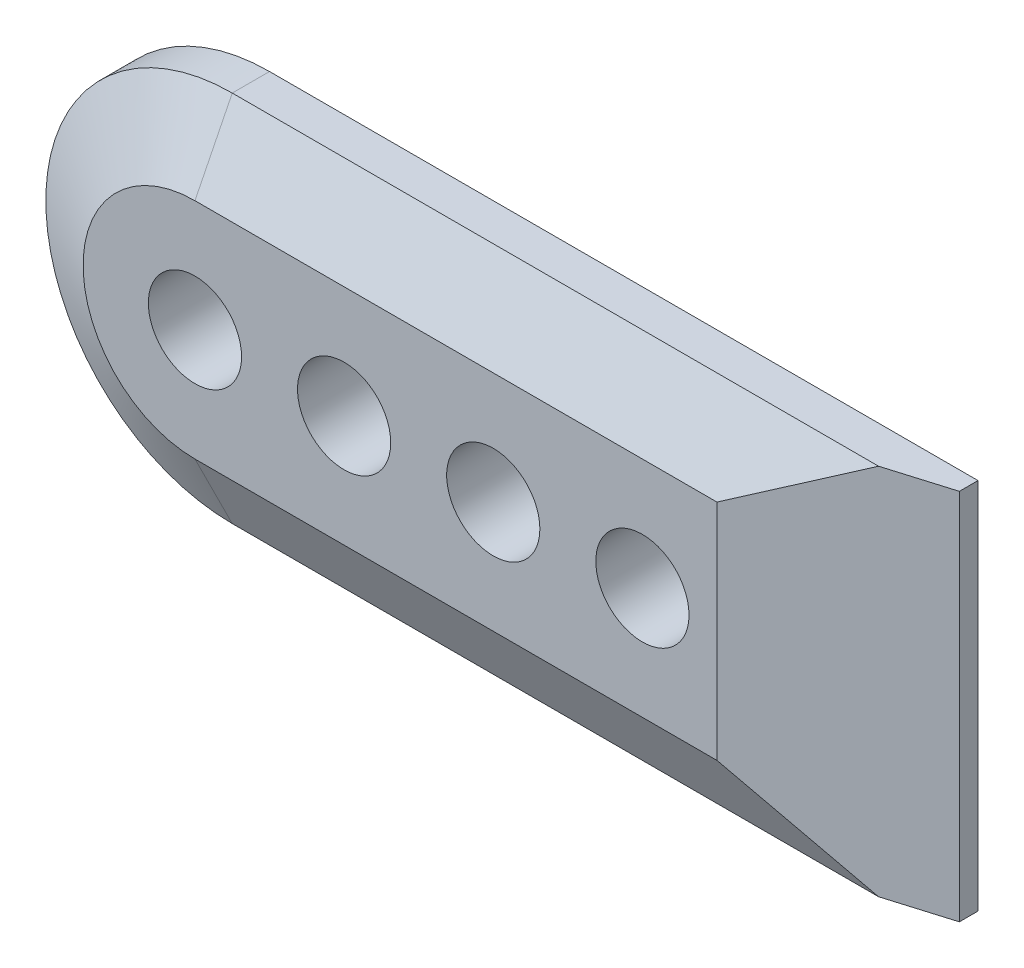
from build123d import *
from OCP.BRepFilletAPI import BRepFilletAPI_MakeChamfer

# Parameters (mm, degrees)
BOSS_EXTRUDE1_DEPTH = 500
CHAMFER1_SIZE       = 250
CHAMFER1_SIZE2      = 500
CHAMFER2_SIZE       = 375
CHAMFER2_SIZE2      = 1250
SKETCH3_R           = 312.5
CUT_EXTRUDE1_DEPTH  = 5391.964663212


with BuildPart() as part:
    # Sketch2 → Boss-Extrude1 (new body)
    with BuildSketch(Plane.XY):
        with BuildLine():
            Line((0, 2500), (4750, 2500))
            Line((4750, 2500), (4750, 0))
            Line((4750, 0), (0, 0))
            ThreePointArc((0, 0), (-1250, 1250), (0, 2500))
        make_face()
    extrude(amount=BOSS_EXTRUDE1_DEPTH)

    # Chamfer1: one chamfer whose edges measure the first distance from different faces: ONE call of the kernel's chamfer builder (chamfer() names one face for all edges)
    chamfer1_edges_1 = [part.edges().sort_by_distance(p)[0] for p in [
        (2375, 2500, 500),
    ]]
    chamfer1_side_1 = [part.faces().sort_by_distance(p)[0] for p in [
        (2375, 2500, 250),
    ]]
    chamfer1_edges_2 = [part.edges().sort_by_distance(p)[0] for p in [
        (-1250, 1250, 500),
    ]]
    chamfer1_side_2 = [part.faces().sort_by_distance(p)[0] for p in [
        (-1250, 1250, 250),
    ]]
    chamfer1_edges_3 = [part.edges().sort_by_distance(p)[0] for p in [
        (2375, 0, 500),
    ]]
    chamfer1_side_3 = [part.faces().sort_by_distance(p)[0] for p in [
        (2375, 0, 250),
    ]]
    chamfer1 = BRepFilletAPI_MakeChamfer(part.part.solid().wrapped)
    for e in chamfer1_edges_1:
        chamfer1.Add(CHAMFER1_SIZE, CHAMFER1_SIZE2, e.wrapped, chamfer1_side_1[0].wrapped)  # the first distance lies on this face
    for e in chamfer1_edges_2:
        chamfer1.Add(CHAMFER1_SIZE, CHAMFER1_SIZE2, e.wrapped, chamfer1_side_2[0].wrapped)  # the first distance lies on this face
    for e in chamfer1_edges_3:
        chamfer1.Add(CHAMFER1_SIZE, CHAMFER1_SIZE2, e.wrapped, chamfer1_side_3[0].wrapped)  # the first distance lies on this face
    add(Compound.cast(chamfer1.Shape()), mode=Mode.REPLACE)

    # Chamfer2
    chamfer2_edges = [part.edges().sort_by_distance(p)[0] for p in [
        (4750, 1250, 500),
    ]]
    chamfer2_side = [part.faces().sort_by_distance(p)[0] for p in [
        (4750, 1250, 231.481481481),
    ]]
    chamfer(chamfer2_edges, length=CHAMFER2_SIZE, length2=CHAMFER2_SIZE2, reference=chamfer2_side[0])

    # Sketch3 → Cut-Extrude1 (cut, through all)
    with BuildSketch(Plane.XY.offset(500)):
        with Locations((0, 1250)):
            Circle(SKETCH3_R)
        with Locations((1000, 1250)):
            Circle(SKETCH3_R)
        with Locations((2000, 1250)):
            Circle(SKETCH3_R)
        with Locations((3000, 1250)):
            Circle(SKETCH3_R)
    extrude(amount=-CUT_EXTRUDE1_DEPTH, mode=Mode.SUBTRACT)


solid = part.part
